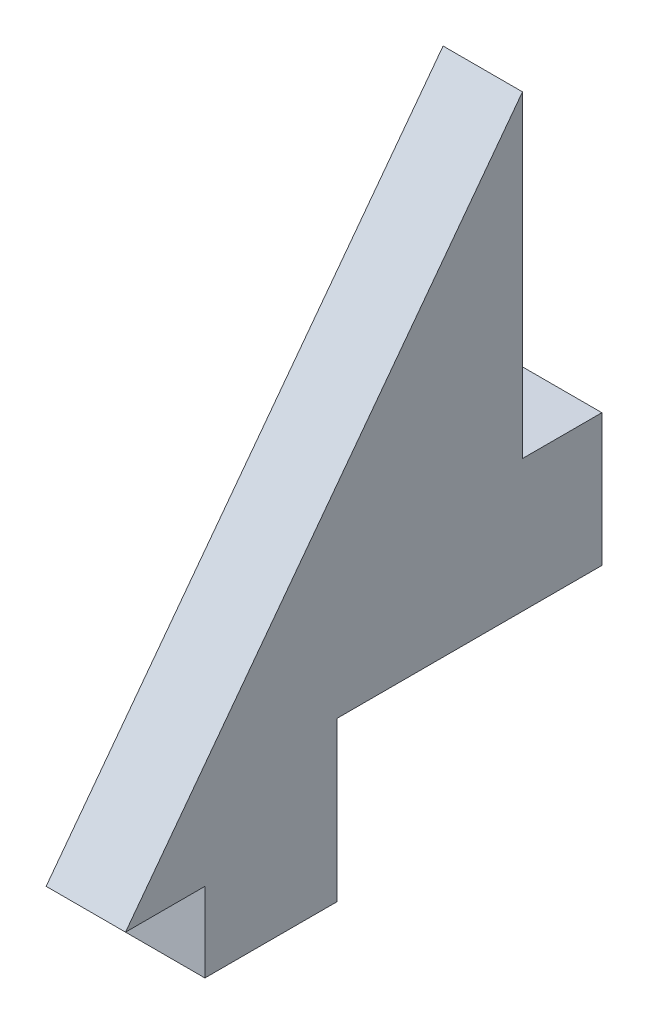
from build123d import *

# Parameters (mm, degrees)
BOSS_EXTRUDE1_DEPTH = 3
SKETCH2_W           = 7
SKETCH2_H           = 3
CUT_EXTRUDE1_DEPTH  = 10


with BuildPart() as part:
    # Sketch1 → Boss-Extrude1 (new body)
    with BuildSketch(Plane(origin=(0, 0, 0), x_dir=(0, 0, -1), z_dir=(1, 0, 0))):
        Polygon((0, 20), (-15, 0), (-12, 0), (-12, -3), (-7, -3), (-7, 0), (0, 0), (0, 3), (3, 3), (3, 8), (0, 8), align=None)
    extrude(amount=BOSS_EXTRUDE1_DEPTH)

    # Sketch2 → Cut-Extrude1 (cut)
    with BuildSketch(Plane(origin=(3, 0, 0), x_dir=(0, 0, -1), z_dir=(1, 0, 0))):
        with Locations((-3.5, 1.5)):
            Rectangle(SKETCH2_W, SKETCH2_H)
    extrude(amount=-CUT_EXTRUDE1_DEPTH, mode=Mode.SUBTRACT)


solid = part.part
